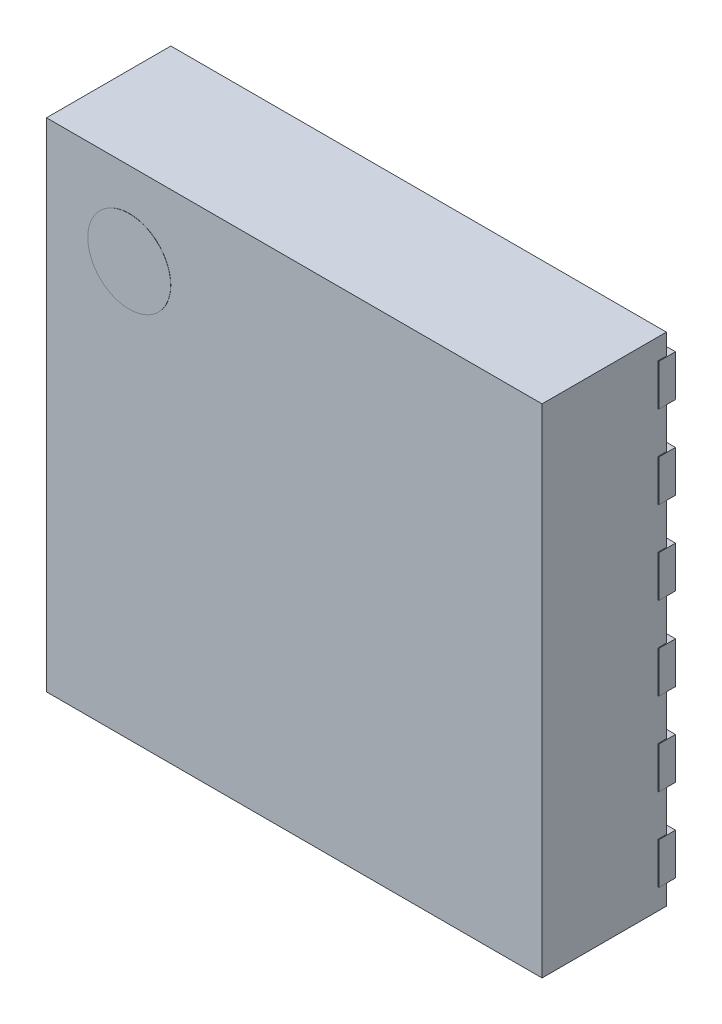
from build123d import *

# Parameters (mm, degrees)
BASE_START  = 0.05
ESQUISSE1_W = 2.99
ESQUISSE1_H = 3
BASE_DEPTH  = 0.75
PADS_DEPTH  = 0.1
ESQUISSE4_R = 0.25
MARK_DEPTH  = 0.001


with BuildPart() as part:
    # Esquisse1 → base (new body)
    with BuildSketch(Plane.XY.offset(BASE_START)):
        Rectangle(ESQUISSE1_W, ESQUISSE1_H)
    extrude(amount=BASE_DEPTH)

    # Esquisse3 → pads (add)
    with BuildSketch(Plane.XY):
        with BuildLine():
            Line((-1.5, 1.375), (-1.205, 1.375))
            ThreePointArc((-1.205, 1.375), (-1.08, 1.25), (-1.205, 1.125))
            Line((-1.205, 1.125), (-1.5, 1.125))
            Line((-1.5, 1.125), (-1.5, 1.375))
        make_face()
        with BuildLine():
            Line((-1.205, 0.625), (-1.5, 0.625))
            Line((-1.5, 0.625), (-1.5, 0.875))
            Line((-1.5, 0.875), (-1.205, 0.875))
            ThreePointArc((-1.205, 0.875), (-1.08, 0.75), (-1.205, 0.625))
        make_face()
        with BuildLine():
            Line((-1.205, 0.125), (-1.5, 0.125))
            Line((-1.5, 0.125), (-1.5, 0.375))
            Line((-1.5, 0.375), (-1.205, 0.375))
            ThreePointArc((-1.205, 0.375), (-1.08, 0.25), (-1.205, 0.125))
        make_face()
        with BuildLine():
            Line((-1.205, -0.375), (-1.5, -0.375))
            Line((-1.5, -0.375), (-1.5, -0.125))
            Line((-1.5, -0.125), (-1.205, -0.125))
            ThreePointArc((-1.205, -0.125), (-1.08, -0.25), (-1.205, -0.375))
        make_face()
        with BuildLine():
            Line((-1.205, -0.875), (-1.5, -0.875))
            Line((-1.5, -0.875), (-1.5, -0.625))
            Line((-1.5, -0.625), (-1.205, -0.625))
            ThreePointArc((-1.205, -0.625), (-1.08, -0.75), (-1.205, -0.875))
        make_face()
        with BuildLine():
            Line((-1.205, -1.375), (-1.5, -1.375))
            Line((-1.5, -1.375), (-1.5, -1.125))
            Line((-1.5, -1.125), (-1.205, -1.125))
            ThreePointArc((-1.205, -1.125), (-1.08, -1.25), (-1.205, -1.375))
        make_face()
        with BuildLine():
            Line((1.5, 1.375), (1.205, 1.375))
            ThreePointArc((1.205, 1.375), (1.08, 1.25), (1.205, 1.125))
            Line((1.205, 1.125), (1.5, 1.125))
            Line((1.5, 1.125), (1.5, 1.375))
        make_face()
        with BuildLine():
            Line((1.5, -1.125), (1.205, -1.125))
            ThreePointArc((1.205, -1.125), (1.08, -1.25), (1.205, -1.375))
            Line((1.205, -1.375), (1.5, -1.375))
            Line((1.5, -1.375), (1.5, -1.125))
        make_face()
        with BuildLine():
            Line((1.5, -0.625), (1.205, -0.625))
            ThreePointArc((1.205, -0.625), (1.08, -0.75), (1.205, -0.875))
            Line((1.205, -0.875), (1.5, -0.875))
            Line((1.5, -0.875), (1.5, -0.625))
        make_face()
        with BuildLine():
            Line((1.5, -0.125), (1.205, -0.125))
            ThreePointArc((1.205, -0.125), (1.08, -0.25), (1.205, -0.375))
            Line((1.205, -0.375), (1.5, -0.375))
            Line((1.5, -0.375), (1.5, -0.125))
        make_face()
        with BuildLine():
            Line((1.5, 0.375), (1.205, 0.375))
            ThreePointArc((1.205, 0.375), (1.08, 0.25), (1.205, 0.125))
            Line((1.205, 0.125), (1.5, 0.125))
            Line((1.5, 0.125), (1.5, 0.375))
        make_face()
        with BuildLine():
            Line((1.5, 0.875), (1.205, 0.875))
            ThreePointArc((1.205, 0.875), (1.08, 0.75), (1.205, 0.625))
            Line((1.205, 0.625), (1.5, 0.625))
            Line((1.5, 0.625), (1.5, 0.875))
        make_face()
        Polygon((-0.65, -1.25), (0.65, -1.25), (0.65, 1.25), (-0.35, 1.25), (-0.65, 0.95), align=None)
    extrude(amount=PADS_DEPTH)

    # Esquisse4 → mark (add)
    with BuildSketch(Plane.XY.offset(0.8)):
        with Locations((-0.995, 1)):
            Circle(ESQUISSE4_R)
    extrude(amount=MARK_DEPTH)


solid = part.part
